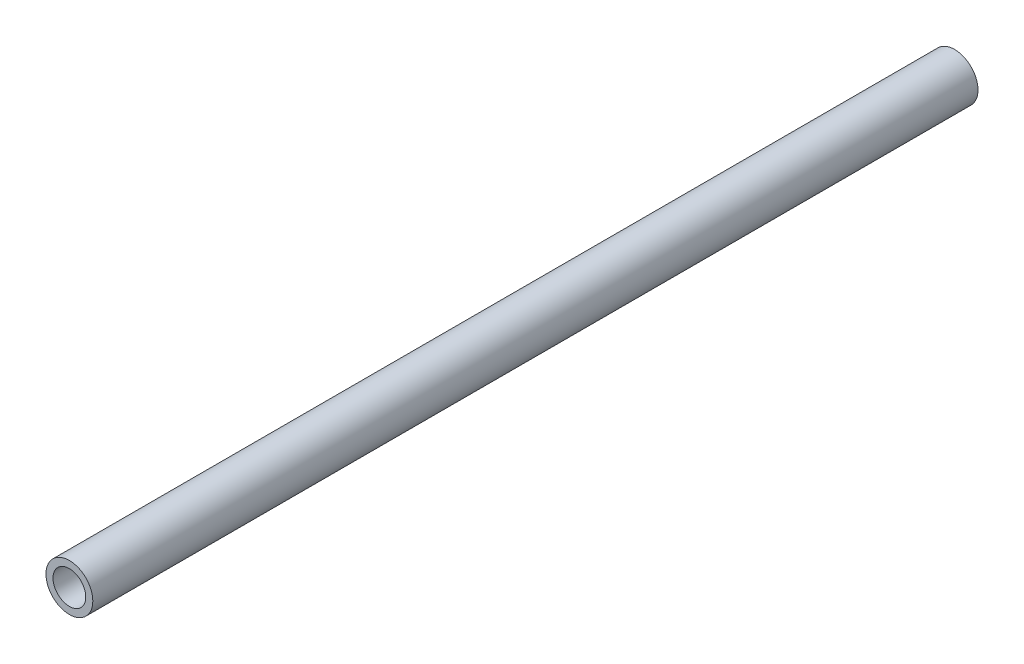
from build123d import *

# Parameters (mm, degrees)
SKETCH1_R           = 15.875
SKETCH1_R_2         = 11.1
BOSS_EXTRUDE1_DEPTH = 600


with BuildPart() as part:
    # Sketch1 → Boss-Extrude1 (new body)
    with BuildSketch(Plane(origin=(0, 0, 0), x_dir=(0, 1, 0), z_dir=(0, 0, 1))):
        with Locations(Location((0, 0, 0), (0, 0, 270))):
            Circle(SKETCH1_R)
        with Locations(Location((0, 0, 0), (0, 0, 270))):
            Circle(SKETCH1_R_2, mode=Mode.SUBTRACT)
    extrude(amount=BOSS_EXTRUDE1_DEPTH)


solid = part.part
